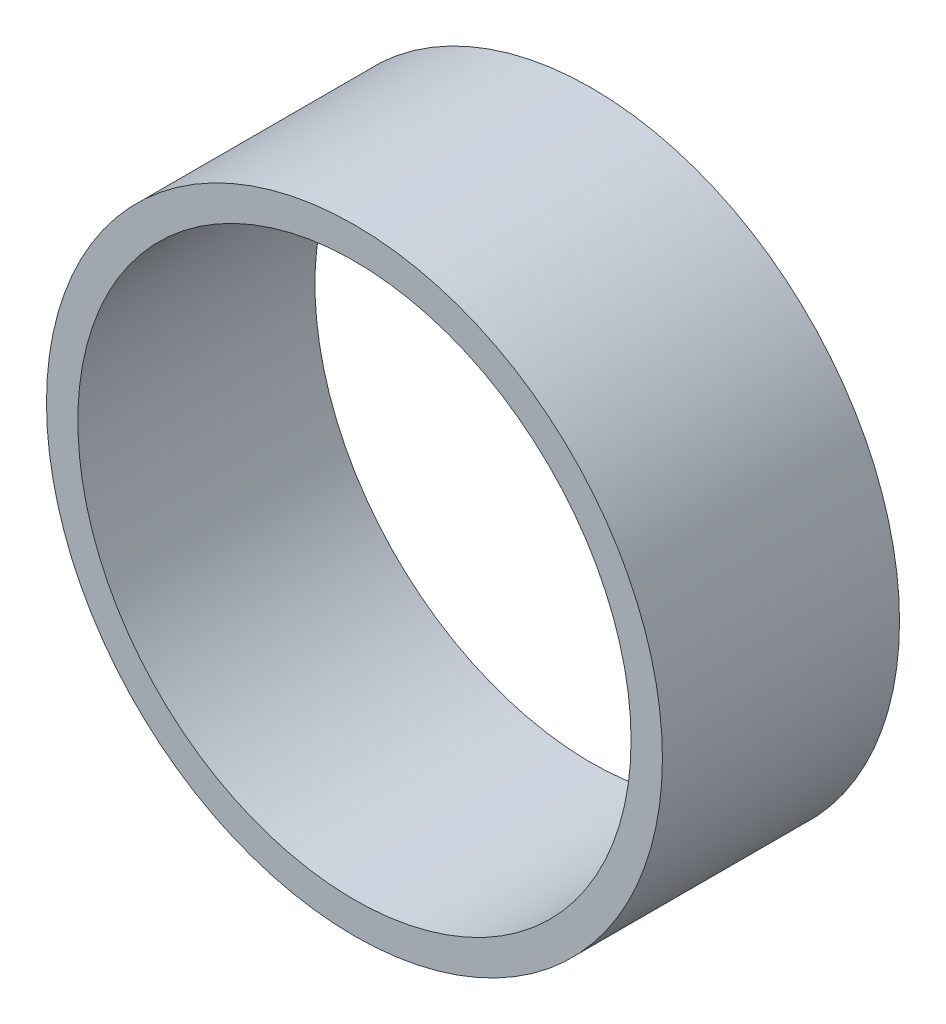
from build123d import *

# Parameters (mm, degrees)
SKETCH2_R           = 14.8463
SKETCH2_R_2         = 13.335
BOSS_EXTRUDE1_DEPTH = 11.43


with BuildPart() as part:
    # Sketch2 → Boss-Extrude1 (new body)
    with BuildSketch(Plane.XY):
        Circle(SKETCH2_R)
        Circle(SKETCH2_R_2, mode=Mode.SUBTRACT)
    extrude(amount=BOSS_EXTRUDE1_DEPTH)


solid = part.part
